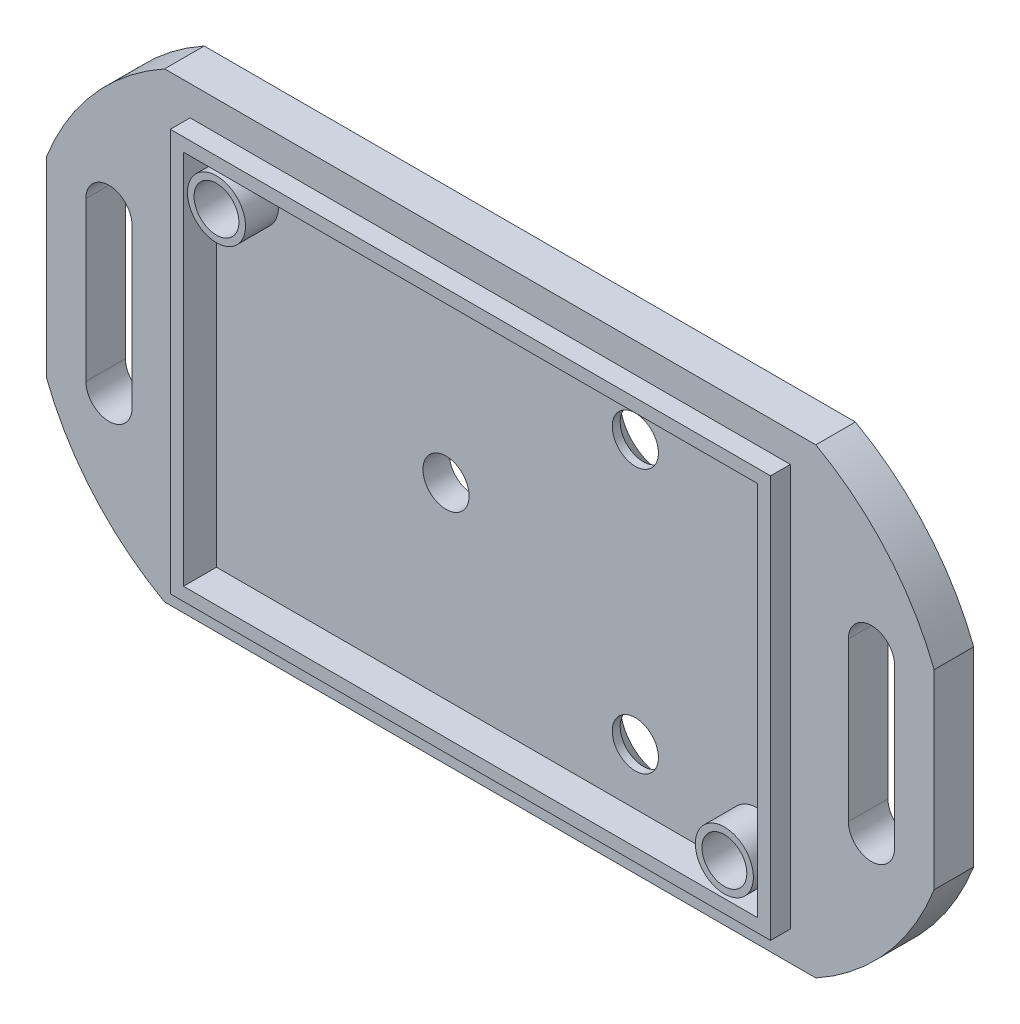
from build123d import *

# Parameters (mm, degrees)
BOSS_EXTRU_1_DEPTH                             = 3
ESQUISSE2_W                                    = 45.5
ESQUISSE2_H                                    = 30.5
BOSS_EXTRU_2_DEPTH                             = 1.5
ESQUISSE3_W                                    = 43.5
ESQUISSE3_H                                    = 28.5
ENL_V_MAT_EXTRU_2_DEPTH                        = 2.5
FRAISAGE_POUR_VIS_T_TE_FRAIS_E_M31_D           = 3.4
FRAISAGE_POUR_VIS_T_TE_FRAIS_E_M31_CSINK_D     = 6.3
FRAISAGE_POUR_VIS_T_TE_FRAIS_E_M31_CSINK_ANGLE = 90
BOSS_EXTRU_3_START                             = 2.5
ESQUISSE6_R                                    = 2.2
ESQUISSE6_R_2                                  = 1.7
BOSS_EXTRU_3_DEPTH                             = 2.5
ENL_V_MAT_EXTRU_3_DEPTH                        = 39.194534949
FRAISAGE_POUR_VIS_T_TE_FRAIS_E_M32_D           = 3.5
FRAISAGE_POUR_VIS_T_TE_FRAIS_E_M32_CSINK_D     = 6.3
FRAISAGE_POUR_VIS_T_TE_FRAIS_E_M32_CSINK_ANGLE = 90
ENL_V_MAT_EXTRU_5_REACH                        = 40.011
ESQUISSE11_R                                   = 1.75


with BuildPart() as part:
    # Esquisse1 → Boss.-Extru.1 (new body)
    with BuildSketch(Plane.XY):
        with BuildLine():
            Line((-24.682458366, 17.5), (24.682458366, 17.5))
            ThreePointArc((24.682458366, 17.5), (30.069312487, 13.149746049), (33.65, 7.223399477))
            Line((33.65, 7.223399477), (33.65, -7.223399477))
            ThreePointArc((33.65, -7.223399477), (30.069312487, -13.149746049), (24.682458366, -17.5))
            Line((24.682458366, -17.5), (-24.682458366, -17.5))
            ThreePointArc((-24.682458366, -17.5), (-30.069312487, -13.149746049), (-33.65, -7.223399477))
            Line((-33.65, -7.223399477), (-33.65, 7.223399477))
            ThreePointArc((-33.65, 7.223399477), (-30.069312487, 13.149746049), (-24.682458366, 17.5))
        make_face()
    extrude(amount=BOSS_EXTRU_1_DEPTH)

    # Esquisse2 → Boss.-Extru.2 (add)
    with BuildSketch(Plane.XY.offset(3)):
        Rectangle(ESQUISSE2_W, ESQUISSE2_H)
    extrude(amount=BOSS_EXTRU_2_DEPTH)

    # Esquisse3 → Enlèv. mat.-Extru.2 (cut)
    with BuildSketch(Plane.XY.offset(4.5)):
        Rectangle(ESQUISSE3_W, ESQUISSE3_H)
    extrude(amount=-ENL_V_MAT_EXTRU_2_DEPTH, mode=Mode.SUBTRACT)

    # Fraisage pour vis à tête fraisée M31 (through all)
    with Locations(Plane(origin=(0, 0, 0), x_dir=(-1, 0, 0), z_dir=(0, 0, -1))):
        with Locations((-19.25, -11.75), (19.25, 11.75)):
            CounterSinkHole(FRAISAGE_POUR_VIS_T_TE_FRAIS_E_M31_D / 2, FRAISAGE_POUR_VIS_T_TE_FRAIS_E_M31_CSINK_D / 2, counter_sink_angle=FRAISAGE_POUR_VIS_T_TE_FRAIS_E_M31_CSINK_ANGLE)

    # Esquisse6 → Boss.-Extru.3 (add)
    # profile 1 of 2: a face of its own
    with BuildSketch(Plane.XY.offset(2).offset(BOSS_EXTRU_3_START)):
        with Locations((-19.25, 11.75)):
            Circle(ESQUISSE6_R)
        with Locations(Location((-19.25, 11.75, 0), (0, 0, 180))):
            Circle(ESQUISSE6_R_2, mode=Mode.SUBTRACT)
    # profile 2 of 2: a face of its own
    with BuildSketch(Plane.XY.offset(2).offset(BOSS_EXTRU_3_START)):
        with Locations((19.25, -11.75)):
            Circle(ESQUISSE6_R)
        with Locations(Location((19.25, -11.75, 0), (0, 0, 180))):
            Circle(ESQUISSE6_R_2, mode=Mode.SUBTRACT)
    extrude(amount=-BOSS_EXTRU_3_DEPTH)

    # Esquisse7 → Enlèv. mat.-Extru.3 (cut, through all)
    with BuildSketch(Plane(origin=(0, 0, 0), x_dir=(-1, 0, 0), z_dir=(0, 0, -1))):
        with BuildLine():
            Line((-27.15, 6), (-27.15, -6))
            ThreePointArc((-27.15, -6), (-28.9, -7.75), (-30.65, -6))
            Line((-30.65, -6), (-30.65, 6))
            ThreePointArc((-30.65, 6), (-28.9, 7.75), (-27.15, 6))
        make_face()
        with BuildLine():
            Line((27.15, 6), (27.15, -6))
            ThreePointArc((27.15, -6), (28.9, -7.75), (30.65, -6))
            Line((30.65, -6), (30.65, 6))
            ThreePointArc((30.65, 6), (28.9, 7.75), (27.15, 6))
        make_face()
    extrude(amount=-ENL_V_MAT_EXTRU_3_DEPTH, mode=Mode.SUBTRACT)

    # Fraisage pour vis à tête fraisée M32 (through all)
    with Locations(Plane(origin=(0, 0, 0), x_dir=(-1, 0, 0), z_dir=(0, 0, -1))):
        with Locations((-10, -10), (-10, 10)):
            CounterSinkHole(FRAISAGE_POUR_VIS_T_TE_FRAIS_E_M32_D / 2, FRAISAGE_POUR_VIS_T_TE_FRAIS_E_M32_CSINK_D / 2, counter_sink_angle=FRAISAGE_POUR_VIS_T_TE_FRAIS_E_M32_CSINK_ANGLE)

    # Esquisse11 → Enlèv. mat.-Extru.5 (cut, up to next)
    with BuildSketch(Plane.XY.offset(2), mode=Mode.PRIVATE) as enl_v_mat_extru_5_sk1:
        with Locations((-4.35, 0)):
            Circle(ESQUISSE11_R)
    enl_v_mat_extru_5_tool1 = extrude(enl_v_mat_extru_5_sk1.sketch, amount=-ENL_V_MAT_EXTRU_5_REACH, mode=Mode.PRIVATE) & part.part
    add(enl_v_mat_extru_5_tool1.solids().sort_by_distance((-4.35, 0, 2))[0], mode=Mode.SUBTRACT)


solid = part.part
